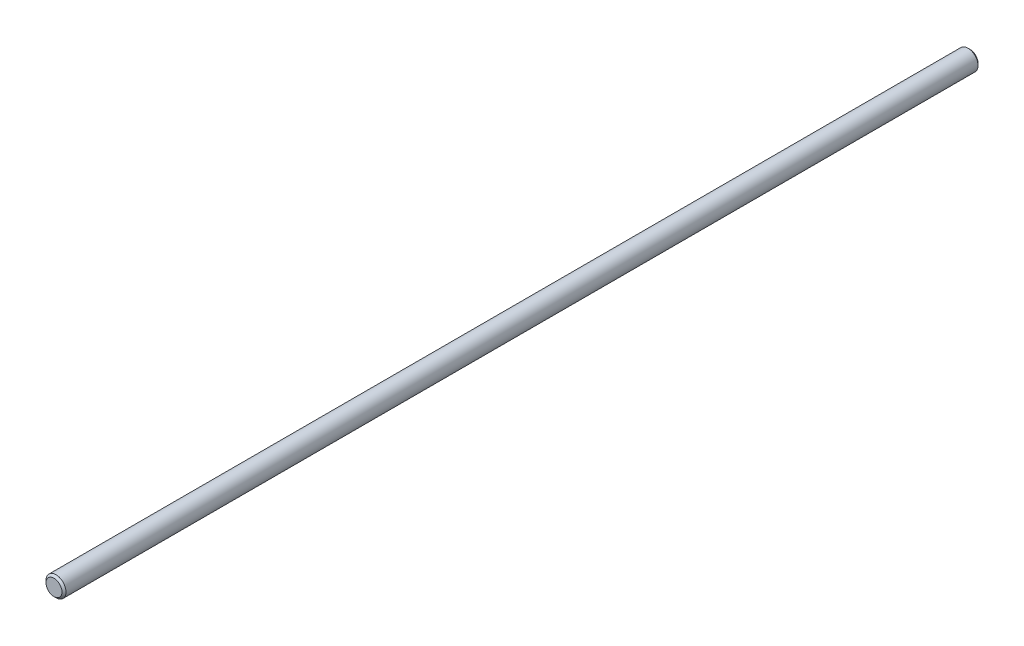
from build123d import *

# Parameters (mm, degrees)
SKETCH1_R      = 6
EXTRUDE1_DEPTH = 275
CHAMFER1_SIZE  = 1.2


with BuildPart() as part:
    # Sketch1 → Extrude1 (new, symmetric)
    with BuildSketch(Plane.XY):
        Circle(SKETCH1_R)
    extrude(amount=EXTRUDE1_DEPTH, both=True)

    # Chamfer1
    chamfer1_edges = [part.edges().sort_by_distance(p)[0] for p in [
        (-6, 0, -275),
        (-6, 0, 275),
    ]]
    chamfer(chamfer1_edges, length=CHAMFER1_SIZE)


solid = part.part
